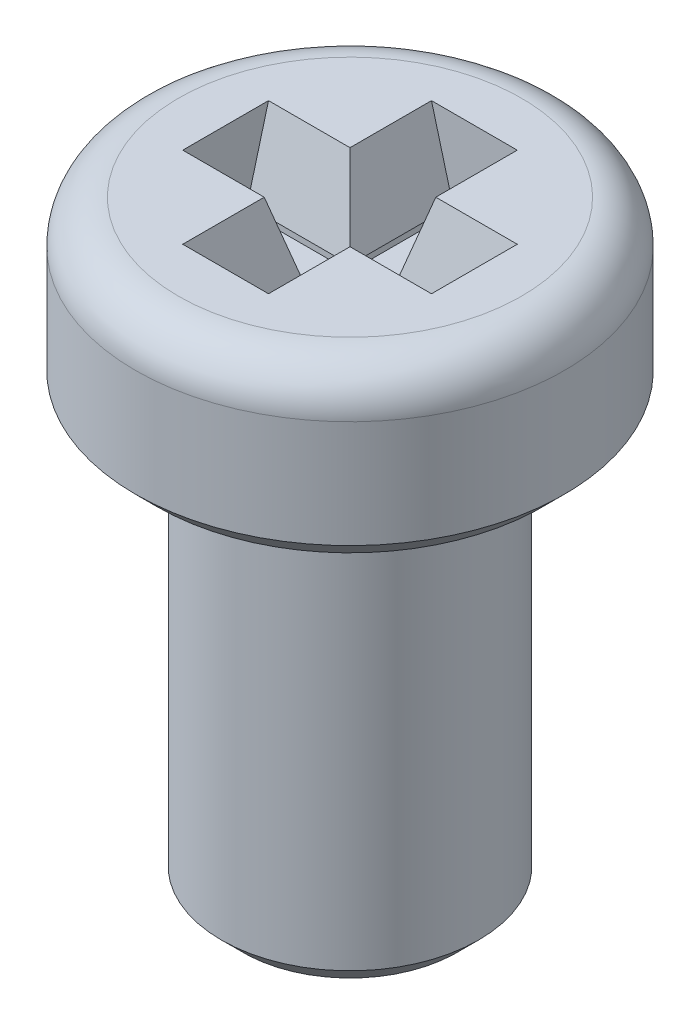
from build123d import *

# Parameters (mm, degrees)
CROQUIS1_R              = 2.5
SALIENTE_EXTRUIR1_DEPTH = 2
CROQUIS2_R              = 1.5
SALIENTE_EXTRUIR2_DEPTH = 5
CHAFL_N1_SIZE           = 0.25
REDONDEO1_R             = 0.5
CORTAR_EXTRUIR1_DEPTH   = 1
CHAFL_N2_SIZE           = 0.25
CHAFL_N2_SIZE2          = 0.933012702


with BuildPart() as part:
    # Croquis1 → Saliente-Extruir1 (new body)
    with BuildSketch(Plane(origin=(0, 0, 0), x_dir=(1, 0, 0), z_dir=(0, 1, 0))):
        with Locations(Location((0, 0, 0), (0, 0, 270))):
            Circle(CROQUIS1_R)
    extrude(amount=SALIENTE_EXTRUIR1_DEPTH)

    # Croquis2 → Saliente-Extruir2 (add)
    with BuildSketch(Plane.XZ):
        with Locations(Location((0, 0, 0), (0, 0, 90))):
            Circle(CROQUIS2_R)
    extrude(amount=SALIENTE_EXTRUIR2_DEPTH)

    # Chaflán1
    chafl_n1_edges = [part.edges().sort_by_distance(p)[0] for p in [
        (0, 0, -2.5),
        (0, -5, -1.5),
    ]]
    chamfer(chafl_n1_edges, length=CHAFL_N1_SIZE)

    # Redondeo1
    redondeo1_edges = [part.edges().sort_by_distance(p)[0] for p in [
        (0, 2, -2.5),
    ]]
    fillet(redondeo1_edges, radius=REDONDEO1_R)

    # Croquis3 → Cortar-Extruir1 (cut)
    with BuildSketch(Plane(origin=(0, 2, 0), x_dir=(1, 0, 0), z_dir=(0, 1, 0))):
        Polygon((0.25, 0.25), (1.45, 0.25), (1.45, -0.25), (0.25, -0.25), (0.25, -1.45), (-0.25, -1.45), (-0.25, -0.25), (-1.45, -0.25), (-1.45, 0.25), (-0.25, 0.25), (-0.25, 1.45), (0.25, 1.45), align=None)
    extrude(amount=-CORTAR_EXTRUIR1_DEPTH, mode=Mode.SUBTRACT)

    # Chaflán2
    chafl_n2_edges = [part.edges().sort_by_distance(p)[0] for p in [
        (-0.25, 2, -0.85),
        (-0.85, 2, -0.25),
        (-0.85, 2, 0.25),
        (-0.25, 2, 0.85),
        (0.25, 2, 0.85),
        (0.85, 2, 0.25),
        (0.85, 2, -0.25),
        (0.25, 2, -0.85),
    ]]
    chafl_n2_side = [part.faces().sort_by_distance(p)[0] for p in [
        (0, 2, -1.943431458),
    ]]
    chamfer(chafl_n2_edges, length=CHAFL_N2_SIZE, length2=CHAFL_N2_SIZE2, reference=chafl_n2_side[0])


solid = part.part
